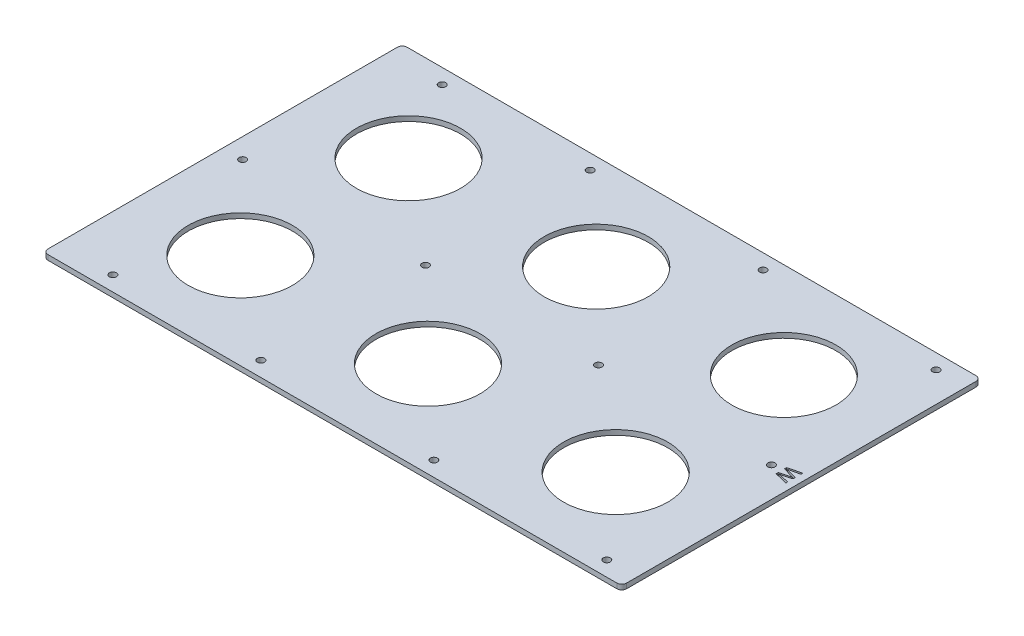
from build123d import *

# Parameters (mm, degrees)
SKETCH1_R           = 33.147
SKETCH1_R_2         = 2.2479
BOSS_EXTRUDE1_DEPTH = 3.175
CUT_EXTRUDE1_DEPTH  = 1.524


with BuildPart() as part:
    # Sketch1 → Boss-Extrude1 (new body)
    with BuildSketch(Plane(origin=(0, 0, 0), x_dir=(1, 0, 0), z_dir=(0, 1, 0))):
        with BuildLine():
            Line((-180.975, 114.3), (180.975, 114.3))
            ThreePointArc((180.975, 114.3), (183.22006403, 113.37006403), (184.15, 111.125))
            Line((184.15, 111.125), (184.15, -111.125))
            ThreePointArc((184.15, -111.125), (183.22006403, -113.37006403), (180.975, -114.3))
            Line((180.975, -114.3), (-180.975, -114.3))
            ThreePointArc((-180.975, -114.3), (-183.22006403, -113.37006403), (-184.15, -111.125))
            Line((-184.15, -111.125), (-184.15, 111.125))
            ThreePointArc((-184.15, 111.125), (-183.22006403, 113.37006403), (-180.975, 114.3))
        make_face()
        with Locations(Location((119.508581684, -53.5178, 0), (0, 0, 270))):
            Circle(SKETCH1_R, mode=Mode.SUBTRACT)
        with Locations(Location((165.1, 0, 0), (0, 0, 270))):
            Circle(SKETCH1_R_2, mode=Mode.SUBTRACT)
        with Locations(Location((-171.45, 0, 0), (0, 0, 270))):
            Circle(SKETCH1_R_2, mode=Mode.SUBTRACT)
        with Locations(Location((-55.033333333, 0, 0), (0, 0, 270))):
            Circle(SKETCH1_R_2, mode=Mode.SUBTRACT)
        with Locations(Location((55.033333333, 0, 0), (0, 0, 270))):
            Circle(SKETCH1_R_2, mode=Mode.SUBTRACT)
        with Locations(Location((119.508581684, 53.5178, 0), (0, 0, 270))):
            Circle(SKETCH1_R, mode=Mode.SUBTRACT)
        with Locations(Location((0.064290842, 53.5178, 0), (0, 0, 270))):
            Circle(SKETCH1_R, mode=Mode.SUBTRACT)
        with Locations(Location((0.064290842, -53.5178, 0), (0, 0, 270))):
            Circle(SKETCH1_R, mode=Mode.SUBTRACT)
        with Locations(Location((-119.38, 53.5178, 0), (0, 0, 270))):
            Circle(SKETCH1_R, mode=Mode.SUBTRACT)
        with Locations(Location((-119.38, -53.5178, 0), (0, 0, 270))):
            Circle(SKETCH1_R, mode=Mode.SUBTRACT)
        with Locations(Location((-149.225, -104.775, 0), (0, 0, 270))):
            Circle(SKETCH1_R_2, mode=Mode.SUBTRACT)
        with Locations(Location((-55.033333333, -104.775, 0), (0, 0, 270))):
            Circle(SKETCH1_R_2, mode=Mode.SUBTRACT)
        with Locations(Location((55.033333333, -104.775, 0), (0, 0, 270))):
            Circle(SKETCH1_R_2, mode=Mode.SUBTRACT)
        with Locations(Location((165.1, -104.775, 0), (0, 0, 270))):
            Circle(SKETCH1_R_2, mode=Mode.SUBTRACT)
        with Locations(Location((-149.225, 104.775, 0), (0, 0, 270))):
            Circle(SKETCH1_R_2, mode=Mode.SUBTRACT)
        with Locations(Location((-55.033333333, 104.775, 0), (0, 0, 270))):
            Circle(SKETCH1_R_2, mode=Mode.SUBTRACT)
        with Locations(Location((55.033333333, 104.775, 0), (0, 0, 270))):
            Circle(SKETCH1_R_2, mode=Mode.SUBTRACT)
        with Locations(Location((165.1, 104.775, 0), (0, 0, 270))):
            Circle(SKETCH1_R_2, mode=Mode.SUBTRACT)
    extrude(amount=BOSS_EXTRUDE1_DEPTH)

    # Sketch2 → Cut-Extrude1 (cut)
    with BuildSketch(Plane(origin=(0, 3.175, 0), x_dir=(1, 0, 0), z_dir=(0, 1, 0))):
        with BuildLine():
            Line((171.45, 3.35692423), (179.668619792, 5.426396401))
            Line((179.668619792, 5.426396401), (179.668619792, 4.229494039))
            Line((179.668619792, 4.229494039), (174.263626046, 3.009542664))
            add(Edge.make_bspline(
                [(174.263626046, 3.009542664), (173.984868687, 2.946317196), (173.430199851, 2.82051174), (172.875222779, 2.696073098), (172.599157976, 2.63417301)],
                knots=[0, 0, 0, 0, 1.00513078, 2, 2, 2, 2], degree=3))
            add(Edge.make_bspline(
                [(172.599157976, 2.63417301), (172.698424046, 2.604865261), (172.8858203, 2.549537571), (173.151472547, 2.474745256), (173.383326442, 2.406813793), (173.582462852, 2.348939672), (173.749161553, 2.302079221), (173.881374159, 2.261620439), (173.981689825, 2.234044239), (174.036994185, 2.217702533), (174.059477638, 2.21105897)],
                knots=[0, 0, 0, 0, 1.633809233, 3.084334118, 4.356383392, 5.447555203, 6.357852567, 7.089694452, 7.629924063, 8, 8, 8, 8], degree=3))
            Line((174.059477638, 2.21105897), (179.668619792, 0.587749853))
            Line((179.668619792, 0.587749853), (179.668619792, -0.806715484))
            Line((179.668619792, -0.806715484), (175.551078105, -1.980568832))
            add(Edge.make_bspline(
                [(175.551078105, -1.980568832), (175.296712529, -2.045349191), (174.795158662, -2.173082039), (174.048075598, -2.342795744), (173.319116921, -2.49943607), (172.836990124, -2.589663839), (172.599157976, -2.63417301)],
                knots=[0, 0, 0, 0, 1.04154457, 2.053700482, 3.039894486, 4, 4, 4, 4], degree=3))
            add(Edge.make_bspline(
                [(172.599157976, -2.63417301), (172.720980898, -2.661645998), (172.977226876, -2.719433502), (173.381816931, -2.809933441), (173.825093055, -2.910447181), (174.134101714, -2.979956246), (174.294906851, -3.016128097)],
                knots=[0, 0, 0, 0, 0.862132589, 1.813435466, 2.862132822, 4, 4, 4, 4], degree=3))
            Line((174.294906851, -3.016128097), (179.668619792, -4.229494039))
            Line((179.668619792, -4.229494039), (179.668619792, -5.426396401))
            Line((179.668619792, -5.426396401), (171.45, -3.355277872))
            Line((171.45, -3.355277872), (171.45, -2.080996678))
            Line((171.45, -2.080996678), (177.730856271, -0.363845147))
            add(Edge.make_bspline(
                [(177.730856271, -0.363845147), (177.792257478, -0.346602472), (177.908896909, -0.31384781), (178.075345329, -0.27091412), (178.221729866, -0.228338076), (178.349942301, -0.194473031), (178.458690649, -0.165165669), (178.547656515, -0.139212748), (178.618581103, -0.122520526), (178.658892529, -0.110449487), (178.675865838, -0.10536692)],
                knots=[0, 0, 0, 0, 1.562239628, 2.967673567, 4.210417925, 5.296319877, 6.215971374, 6.969386481, 7.566055473, 8, 8, 8, 8], degree=3))
            add(Edge.make_bspline(
                [(178.675865838, -0.10536692), (178.568229296, -0.074892118), (178.364849129, -0.017309719), (178.078532422, 0.067967153), (177.826773257, 0.139523409), (177.671018148, 0.184870245), (177.599147621, 0.205794766)],
                knots=[0, 0, 0, 0, 1.197730334, 2.263121701, 3.198547257, 4, 4, 4, 4], degree=3))
            Line((177.599147621, 0.205794766), (171.45, 1.985507906))
            Line((171.45, 1.985507906), (171.45, 3.35692423))
        make_face()
    extrude(amount=-CUT_EXTRUDE1_DEPTH, mode=Mode.SUBTRACT)


solid = part.part
